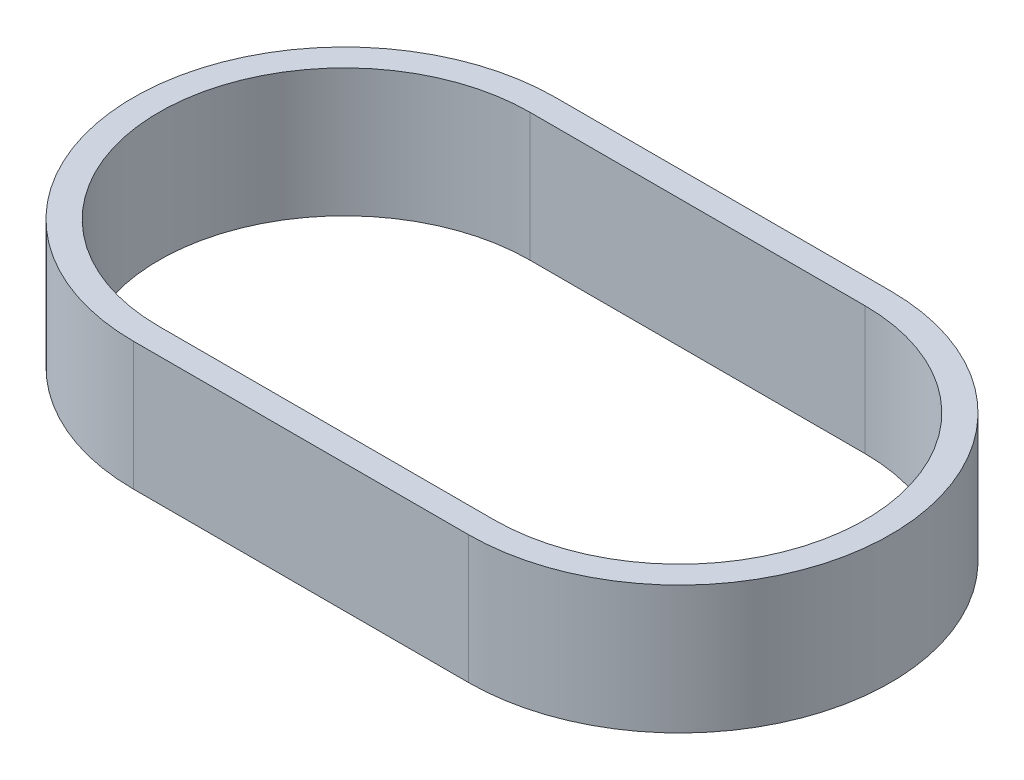
from build123d import *

# Parameters (mm, degrees)
BOSS_EXTRUDE1_DEPTH = 10


with BuildPart() as part:
    # Sketch1 → Boss-Extrude1 (new body)
    with BuildSketch(Plane(origin=(0, 0, 0), x_dir=(1, 0, 0), z_dir=(0, 1, 0))):
        with BuildLine():
            Line((-13.081, 16.478), (13.081, 16.478))
            ThreePointArc((13.081, 16.478), (29.559, 0), (13.081, -16.478))
            Line((13.081, -16.478), (-13.081, -16.478))
            ThreePointArc((-13.081, -16.478), (-29.559, 0), (-13.081, 16.478))
        make_face()
        with BuildLine():
            Line((-13.081, 14.478), (13.081, 14.478))
            ThreePointArc((13.081, 14.478), (27.559, 0), (13.081, -14.478))
            Line((13.081, -14.478), (-13.081, -14.478))
            ThreePointArc((-13.081, -14.478), (-27.559, 0), (-13.081, 14.478))
        make_face(mode=Mode.SUBTRACT)
    extrude(amount=BOSS_EXTRUDE1_DEPTH)


solid = part.part
